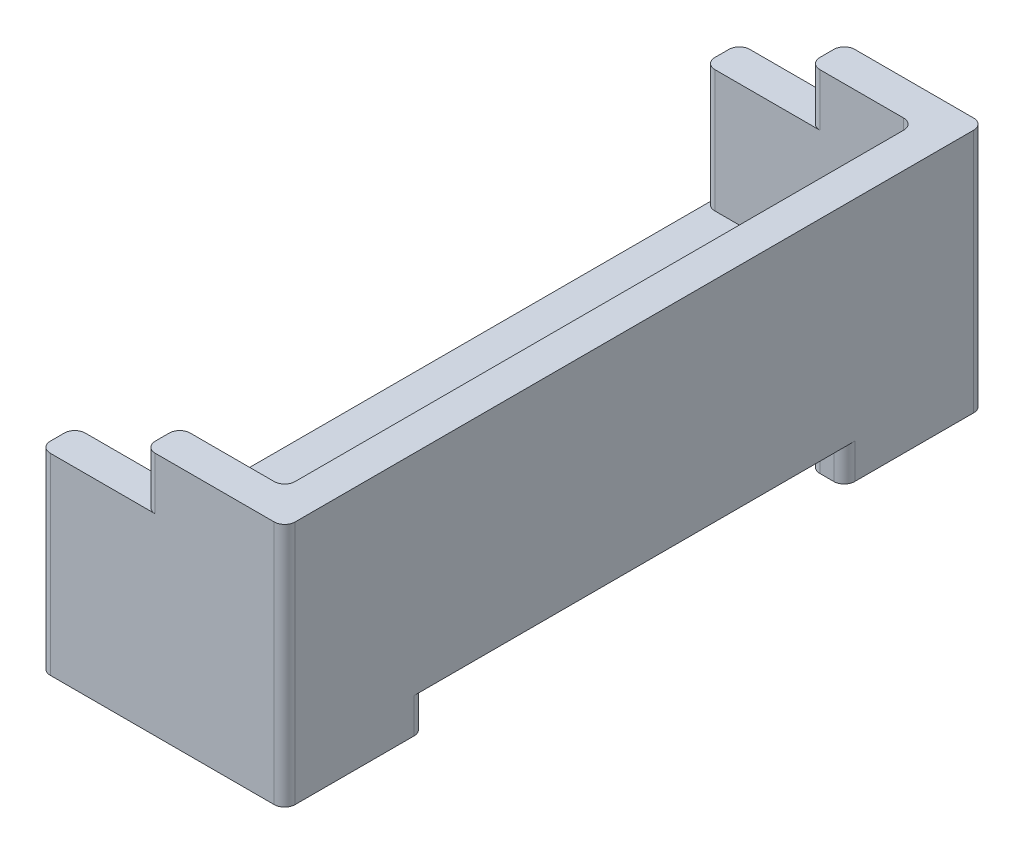
from build123d import *

# Parameters (mm, degrees)
SKETCH1_W           = 270
SKETCH1_H           = 200
BOSS_EXTRUDE1_DEPTH = 10
SKETCH10_W          = 40
SKETCH10_H          = 50
CUT_EXTRUDE1_DEPTH  = 5
SKETCH10_3_W        = 40
SKETCH10_3_H        = 50
BOSS_EXTRUDE2_DEPTH = 5
SKETCH12_R          = 3
CUT_EXTRUDE2_DEPTH  = 5
SKETCH12_3_R        = 3
CUT_EXTRUDE3_DEPTH  = 5
BOSS_EXTRUDE3_DEPTH = 50
CUT_EXTRUDE4_REACH  = 341.706
SKETCH15_R          = 2.75
CUT_EXTRUDE5_REACH  = 341.706
SKETCH16_R          = 3
SKETCH17_W          = 230
SKETCH17_H          = 10
CUT_EXTRUDE6_DEPTH  = 15
CUT_EXTRUDE7_REACH  = 341.006
SKETCH18_W          = 240
SKETCH18_H          = 200
BOSS_EXTRUDE4_DEPTH = 10
FILLET1_R           = 3


with BuildPart() as part:
    # Sketch1 → Boss-Extrude1 (new body)
    with BuildSketch(Plane(origin=(0, 0, 0), x_dir=(1, 0, 0), z_dir=(0, 1, 0))):
        with Locations((135, 100)):
            Rectangle(SKETCH1_W, SKETCH1_H)
    extrude(amount=-BOSS_EXTRUDE1_DEPTH)

    # Sketch10 → Cut-Extrude1 (cut)
    with BuildSketch(Plane(origin=(0, 0, 0), x_dir=(1, 0, 0), z_dir=(0, 1, 0))):
        with Locations((20, 150)):
            Rectangle(SKETCH10_W, SKETCH10_H)
    extrude(amount=-CUT_EXTRUDE1_DEPTH, mode=Mode.SUBTRACT)

    # Sketch10<3> → Boss-Extrude2 (add)
    with BuildSketch(Plane(origin=(0, 0, 0), x_dir=(1, 0, 0), z_dir=(0, 1, 0))):
        with Locations((-20, 50)):
            Rectangle(SKETCH10_3_W, SKETCH10_3_H)
    extrude(amount=-BOSS_EXTRUDE2_DEPTH)

    # Sketch12 → Cut-Extrude2 (cut)
    with BuildSketch(Plane(origin=(0, -5, 0), x_dir=(1, 0, 0), z_dir=(0, 1, 0))):
        with Locations((25, 150)):
            Circle(SKETCH12_R)
    extrude(amount=-CUT_EXTRUDE2_DEPTH, mode=Mode.SUBTRACT)

    # Sketch12<3> → Cut-Extrude3 (cut)
    with BuildSketch(Plane(origin=(0, -5, 0), x_dir=(1, 0, 0), z_dir=(0, 1, 0))):
        with Locations((-25, 50)):
            Circle(SKETCH12_3_R)
    extrude(amount=CUT_EXTRUDE3_DEPTH, mode=Mode.SUBTRACT)

    # Sketch13 → Boss-Extrude3 (add)
    with BuildSketch(Plane(origin=(0, 0, 0), x_dir=(1, 0, 0), z_dir=(0, 1, 0))):
        Polygon((0, 190), (260, 190), (260, 10), (0, 10), (0, 0), (270, 0), (270, 200), (0, 200), align=None)
    extrude(amount=BOSS_EXTRUDE3_DEPTH)

    # Sketch15 → Cut-Extrude4 (cut, up to next)
    with BuildSketch(Plane(origin=(0, 0, 0), x_dir=(1, 0, 0), z_dir=(0, 1, 0)), mode=Mode.PRIVATE) as cut_extrude4_sk1:
        with Locations((230, 78.5)):
            Circle(SKETCH15_R)
    cut_extrude4_tool1 = extrude(cut_extrude4_sk1.sketch, amount=-CUT_EXTRUDE4_REACH, mode=Mode.PRIVATE) & part.part
    # Sketch15 → Cut-Extrude4 (cut, up to next)
    with BuildSketch(Plane(origin=(0, 0, 0), x_dir=(1, 0, 0), z_dir=(0, 1, 0)), mode=Mode.PRIVATE) as cut_extrude4_sk2:
        with Locations((230, 121.5)):
            Circle(SKETCH15_R)
    cut_extrude4_tool2 = extrude(cut_extrude4_sk2.sketch, amount=-CUT_EXTRUDE4_REACH, mode=Mode.PRIVATE) & part.part
    add(cut_extrude4_tool1.solids().sort_by_distance((230, 0, -78.5))[0], mode=Mode.SUBTRACT)
    add(cut_extrude4_tool2.solids().sort_by_distance((230, 0, -121.5))[0], mode=Mode.SUBTRACT)

    # Sketch16 → Cut-Extrude5 (cut, up to next)
    with BuildSketch(Plane(origin=(0, 0, 0), x_dir=(1, 0, 0), z_dir=(0, 1, 0)), mode=Mode.PRIVATE) as cut_extrude5_sk1:
        with Locations((230, 143)):
            Circle(SKETCH16_R)
    cut_extrude5_tool1 = extrude(cut_extrude5_sk1.sketch, amount=-CUT_EXTRUDE5_REACH, mode=Mode.PRIVATE) & part.part
    # Sketch16 → Cut-Extrude5 (cut, up to next)
    with BuildSketch(Plane(origin=(0, 0, 0), x_dir=(1, 0, 0), z_dir=(0, 1, 0)), mode=Mode.PRIVATE) as cut_extrude5_sk2:
        with Locations((230, 175)):
            Circle(SKETCH16_R)
    cut_extrude5_tool2 = extrude(cut_extrude5_sk2.sketch, amount=-CUT_EXTRUDE5_REACH, mode=Mode.PRIVATE) & part.part
    # Sketch16 → Cut-Extrude5 (cut, up to next)
    with BuildSketch(Plane(origin=(0, 0, 0), x_dir=(1, 0, 0), z_dir=(0, 1, 0)), mode=Mode.PRIVATE) as cut_extrude5_sk3:
        with Locations((230, 57)):
            Circle(SKETCH16_R)
    cut_extrude5_tool3 = extrude(cut_extrude5_sk3.sketch, amount=-CUT_EXTRUDE5_REACH, mode=Mode.PRIVATE) & part.part
    # Sketch16 → Cut-Extrude5 (cut, up to next)
    with BuildSketch(Plane(origin=(0, 0, 0), x_dir=(1, 0, 0), z_dir=(0, 1, 0)), mode=Mode.PRIVATE) as cut_extrude5_sk4:
        with Locations((230, 25)):
            Circle(SKETCH16_R)
    cut_extrude5_tool4 = extrude(cut_extrude5_sk4.sketch, amount=-CUT_EXTRUDE5_REACH, mode=Mode.PRIVATE) & part.part
    add(cut_extrude5_tool1.solids().sort_by_distance((230, 0, -143))[0], mode=Mode.SUBTRACT)
    add(cut_extrude5_tool2.solids().sort_by_distance((230, 0, -175))[0], mode=Mode.SUBTRACT)
    add(cut_extrude5_tool3.solids().sort_by_distance((230, 0, -57))[0], mode=Mode.SUBTRACT)
    add(cut_extrude5_tool4.solids().sort_by_distance((230, 0, -25))[0], mode=Mode.SUBTRACT)

    # Sketch17 → Cut-Extrude6 (cut)
    with BuildSketch(Plane(origin=(0, 50, 0), x_dir=(1, 0, 0), z_dir=(0, 1, 0))):
        with Locations((115, 5)):
            Rectangle(SKETCH17_W, SKETCH17_H)
        with Locations((115, 195)):
            Rectangle(SKETCH17_W, SKETCH17_H)
    extrude(amount=-CUT_EXTRUDE6_DEPTH, mode=Mode.SUBTRACT)

    # Sketch18 → Cut-Extrude7 (cut, up to next)
    with BuildSketch(Plane(origin=(0, 35, 0), x_dir=(1, 0, 0), z_dir=(0, 1, 0)), mode=Mode.PRIVATE) as cut_extrude7_sk1:
        with Locations((80, 100)):
            Rectangle(SKETCH18_W, SKETCH18_H)
    cut_extrude7_tool1 = extrude(cut_extrude7_sk1.sketch, amount=-CUT_EXTRUDE7_REACH, mode=Mode.PRIVATE) & part.part
    add(cut_extrude7_tool1.solids().sort_by_distance((80, 35, -100))[0], mode=Mode.SUBTRACT)

    # Sketch14 → Boss-Extrude4 (add)
    with BuildSketch(Plane.XZ.offset(10)):
        Polygon((200, -190), (260, -190), (260, -160), (270, -160), (270, -200), (200, -200), align=None)
        Polygon((270, 0), (200, 0), (200, -10), (260, -10), (260, -40), (270, -40), align=None)
    extrude(amount=BOSS_EXTRUDE4_DEPTH)

    # Fillet1
    fillet1_edges = [part.edges().sort_by_distance(p)[0] for p in [
        (200, 7.5, 0),
        (200, -15, -10),
        (260, -15, -10),
        (260, -15, -40),
        (270, -15, -40),
        (260, -15, -160),
        (270, -15, -160),
        (270, 15, -200),
        (200, 7.5, -200),
        (200, -15, -190),
        (260, -15, -190),
        (200, 17.5, -10),
        (230, 42.5, 0),
        (230, 42.5, -10),
        (260, 25, -10),
        (260, 25, -190),
        (230, 42.5, -200),
        (230, 42.5, -190),
        (200, 17.5, -190),
        (270, 15, 0),
    ]]
    fillet(fillet1_edges, radius=FILLET1_R)


solid = part.part
